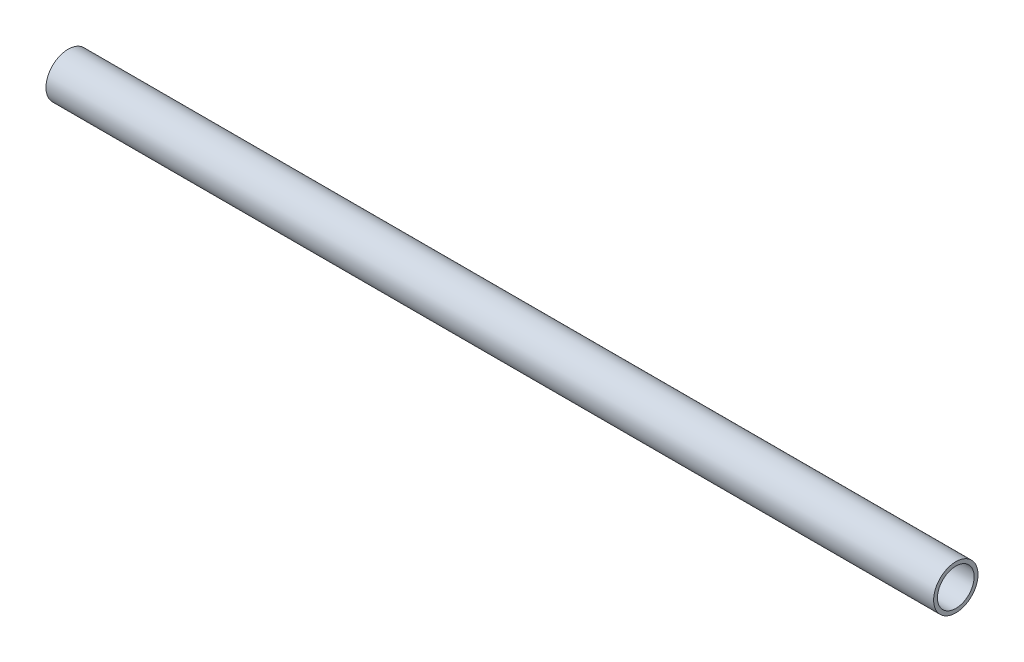
from build123d import *

# Parameters (mm, degrees)
SWEEP1_PROFILE_R     = 9.525
CUT_SWEEP1_PROFILE_R = 7.874


with BuildPart() as part:
    # Sweep1: sweep along a path in Sketch1
    with BuildLine(Plane.XY) as sweep1_path:
        Line((0, 0), (381, 0))
    # Sweep1 profile (on start of the path) → Sweep1 (sweep)
    with BuildSketch(Plane(origin=(0, 0, 0), x_dir=(0, 0, 1), z_dir=(1, 0, 0))):
        Circle(SWEEP1_PROFILE_R)
    sweep(path=sweep1_path.line)

    # Cut-Sweep1: sweep along a path in Sketch1<2>
    with BuildLine(Plane.XY) as cut_sweep1_path:
        Line((0, 0), (381, 0))
    # Cut-Sweep1 profile (on start of the path) → Cut-Sweep1 (sweep, cut)
    with BuildSketch(Plane(origin=(0, 0, 0), x_dir=(0, 0, 1), z_dir=(1, 0, 0))):
        Circle(CUT_SWEEP1_PROFILE_R)
    sweep(path=cut_sweep1_path.line, mode=Mode.SUBTRACT)


solid = part.part
